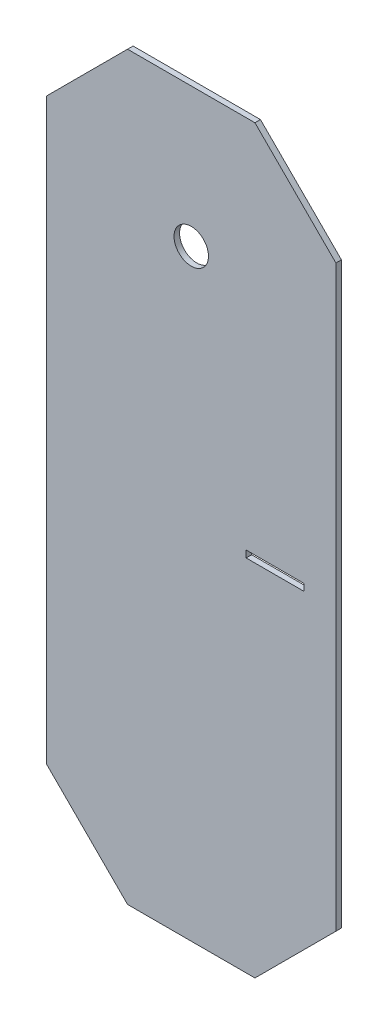
from build123d import *

# Parameters (mm, degrees)
SKETCH_1_R          = 12.5
EXTRUDE_1_DEPTH     = 4
SKETCH_2_W          = 42.16953138
SKETCH_2_H          = 5
CUT_EXTRUDE_1_DEPTH = 650.332288577


with BuildPart() as part:
    # Эскиз1 → Вытянуть1 (new body)
    with BuildSketch(Plane.XY):
        Polygon((-105, 539.996445798), (-105, 203.99388251), (-105, 161.99388251), (-46.222366275, 103.216248785), (46.222366275, 103.216248785), (105, 161.99388251), (105, 203.99388251), (105, 539.996445798), (105, 581.996445798), (46.222366275, 640.774079523), (-46.222366275, 640.774079523), (-105, 581.996445798), align=None)
        with Locations((0, 539.996445798)):
            Circle(SKETCH_1_R, mode=Mode.SUBTRACT)
    extrude(amount=EXTRUDE_1_DEPTH)

    # Эскиз2 → Вырез-Вытянуть1 (cut, through all)
    with BuildSketch(Plane.XY.offset(4)):
        with Locations((60.913039778, 366.536195337)):
            Rectangle(SKETCH_2_W, SKETCH_2_H)
    extrude(amount=-CUT_EXTRUDE_1_DEPTH, mode=Mode.SUBTRACT)


solid = part.part
